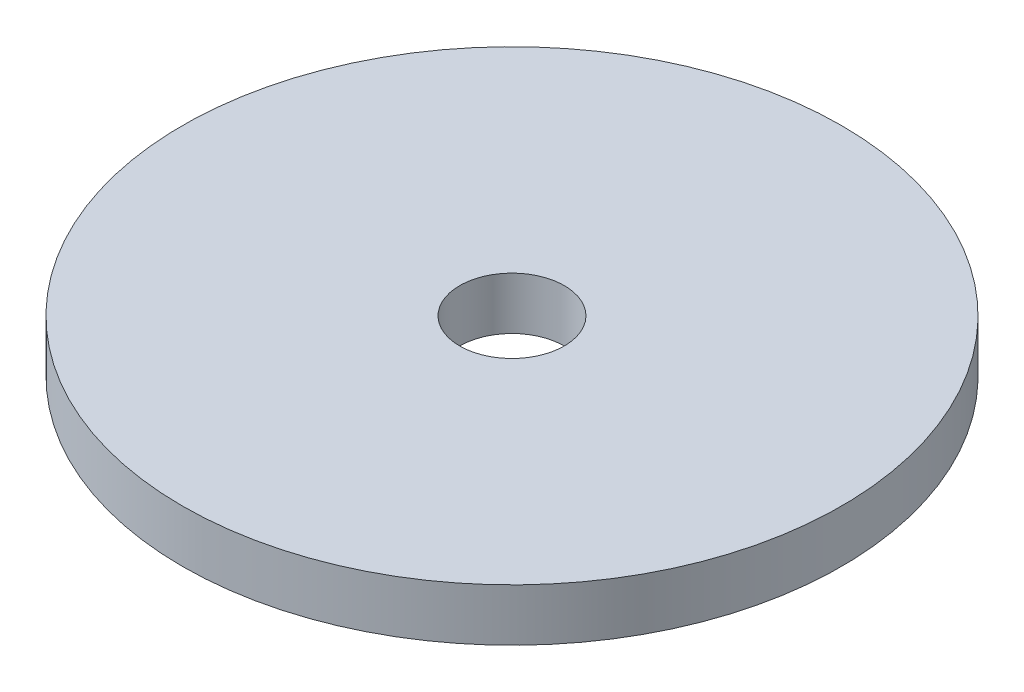
from build123d import *

# Parameters (mm, degrees)
SKETCH1_R           = 20
SKETCH1_R_2         = 3.175
BOSS_EXTRUDE1_DEPTH = 3.175


with BuildPart() as part:
    # Sketch1 → Boss-Extrude1 (new body)
    with BuildSketch(Plane(origin=(0, 0, 0), x_dir=(1, 0, 0), z_dir=(0, 1, 0))):
        with Locations(Location((0, 0, 0), (0, 0, 270))):
            Circle(SKETCH1_R)
        with Locations(Location((0, 0, 0), (0, 0, 270))):
            Circle(SKETCH1_R_2, mode=Mode.SUBTRACT)
    extrude(amount=BOSS_EXTRUDE1_DEPTH)


solid = part.part
